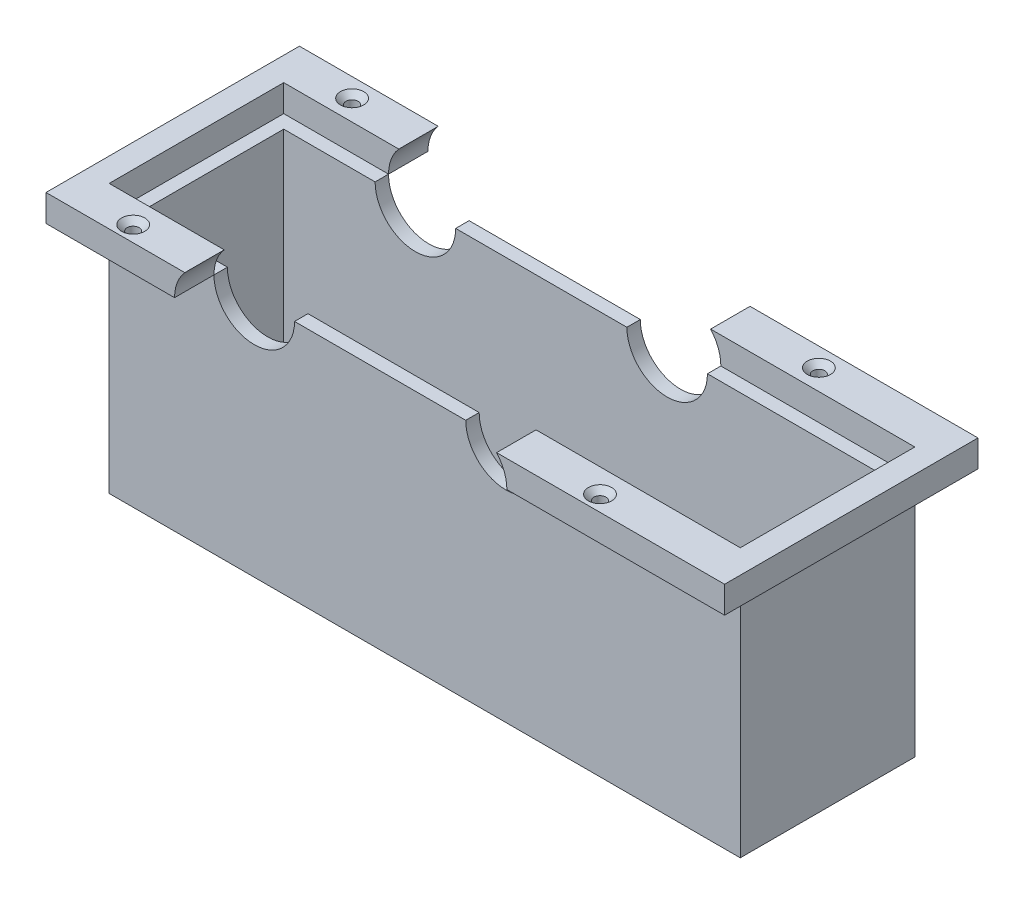
from build123d import *

# Parameters (mm, degrees)
SKETCH1_W                                    = 450
SKETCH1_H                                    = 110
BOSS_EXTRUDE1_DEPTH                          = 170
SHELL1_T                                     = 10
SKETCH2_R                                    = 30
CUT_EXTRUDE1_DEPTH                           = 250
SKETCH4_W                                    = 505.360173326
SKETCH4_H                                    = 188.738784552
SKETCH4_W_2                                  = 470
SKETCH4_H_2                                  = 130
BOSS_EXTRUDE3_DEPTH                          = 20
CUT_EXTRUDE4_DEPTH                           = 75
CUT_EXTRUDE4_DEPTH_BACK                      = 265
SKETCH2_4_R                                  = 30
CSK_FOR_M8_COUNTERSUNK_FLAT_HEAD_SCR_2_COUNT = 2
CSK_FOR_M8_COUNTERSUNK_FLAT_HEAD_SCR_2_PITCH = 163.017631271
CSK_FOR_M8_COUNTERSUNK_FLAT_HEAD_SCR_3_COUNT = 2
CSK_FOR_M8_COUNTERSUNK_FLAT_HEAD_SCR_3_PITCH = 347.641564167
CSK_FOR_M8_COUNTERSUNK_FLAT_HEAD_SCR_4_COUNT = 2
CSK_FOR_M8_COUNTERSUNK_FLAT_HEAD_SCR_4_PITCH = 383.965369847


with BuildPart() as part:
    # Sketch1 → Boss-Extrude1 (new body)
    with BuildSketch(Plane(origin=(0, 0, 0), x_dir=(1, 0, 0), z_dir=(0, 1, 0))):
        Rectangle(SKETCH1_W, SKETCH1_H)
    extrude(amount=BOSS_EXTRUDE1_DEPTH)

    # Shell1
    shell1_openings = [part.faces().sort_by_distance(p)[0] for p in [
        (0, 170, 0),
    ]]
    offset(amount=SHELL1_T, openings=shell1_openings, kind=Kind.INTERSECTION)

    # Sketch2 → Cut-Extrude1 (cut)
    with BuildSketch(Plane.XY.offset(65)):
        with Locations((-126.950391401, 170)):
            Circle(SKETCH2_R)
        with Locations((60.549608599, 170)):
            Circle(SKETCH2_R)
    extrude(amount=-CUT_EXTRUDE1_DEPTH, mode=Mode.SUBTRACT)


with BuildPart() as body_2:
    # Sketch4 → Boss-Extrude3 (new body)
    with BuildSketch(Plane(origin=(0, 170, 0), x_dir=(-1, 0, 0), z_dir=(0, -1, 0))):
        Rectangle(SKETCH4_W, SKETCH4_H)
        Rectangle(SKETCH4_W_2, SKETCH4_H_2, mode=Mode.SUBTRACT)
    extrude(amount=-BOSS_EXTRUDE3_DEPTH)

    # Sketch2<4> → Cut-Extrude4 (cut, two sides: drawn at the far end of the back side and taken through both)
    with BuildSketch(Plane.XY.offset(65).offset(-CUT_EXTRUDE4_DEPTH_BACK)):
        with Locations((-126.950391401, 170)):
            Circle(SKETCH2_4_R)
        with Locations((60.549608599, 170)):
            Circle(SKETCH2_4_R)
    extrude(amount=CUT_EXTRUDE4_DEPTH + CUT_EXTRUDE4_DEPTH_BACK, mode=Mode.SUBTRACT)


with BuildPart() as cut_extrude4_piece_1:
    # of the separate pieces the step leaves, piece 1, a body of its own (cut_extrude4_pieces_kept)
    add(body_2.part.solids().sort_by_distance((90.549608599, 170, -94.369392276))[0])


with BuildPart() as cut_extrude4_piece_2:
    # of the separate pieces the step leaves, piece 2, a body of its own (cut_extrude4_pieces_kept)
    add(body_2.part.solids().sort_by_distance((-252.680086663, 170, -94.369392276))[0])

    # Sketch7 → CSK for M8 Countersunk Flat Head Screw1 (revolve, cut)
    with BuildSketch(Plane(origin=(-199.443365859, 190, -80.345227372), x_dir=(0, 0, 1), z_dir=(1, 0, 0))):
        Polygon((0, 0), (0, 200), (4.5, 200), (4.5, 4.15), (8.65, 0), align=None)
    csk_for_m8_countersunk_flat_head_screw1 = revolve(axis=Axis((-199.443365859, 196.35, -80.345227372), (0, -1, 0)), mode=Mode.SUBTRACT)

    # CSK for M8 Countersunk Flat Head Scr 2: CSK for M8 Countersunk Flat Head Screw1 ×2
    with Locations(*[(0, 0, i * CSK_FOR_M8_COUNTERSUNK_FLAT_HEAD_SCR_2_PITCH) for i in range(1, CSK_FOR_M8_COUNTERSUNK_FLAT_HEAD_SCR_2_COUNT)]):
        add(csk_for_m8_countersunk_flat_head_screw1, mode=Mode.SUBTRACT)


with BuildPart() as cut_extrude4_piece_1_1:
    add(cut_extrude4_piece_1.part)

    # CSK for M8 Countersunk Flat Head Scr 3: CSK for M8 Countersunk Flat Head Screw1 ×2
    with Locations(*[(i * CSK_FOR_M8_COUNTERSUNK_FLAT_HEAD_SCR_3_PITCH, 0, 0) for i in range(1, CSK_FOR_M8_COUNTERSUNK_FLAT_HEAD_SCR_3_COUNT)]):
        add(csk_for_m8_countersunk_flat_head_screw1, mode=Mode.SUBTRACT)

    # CSK for M8 Countersunk Flat Head Scr 4: CSK for M8 Countersunk Flat Head Screw1 ×2
    with Locations(*[Vector(0.9053982245993311, 0, 0.42456336970160213) * (i * CSK_FOR_M8_COUNTERSUNK_FLAT_HEAD_SCR_4_PITCH) for i in range(1, CSK_FOR_M8_COUNTERSUNK_FLAT_HEAD_SCR_4_COUNT)]):
        add(csk_for_m8_countersunk_flat_head_screw1, mode=Mode.SUBTRACT)


solid = Compound([part.part, cut_extrude4_piece_2.part, cut_extrude4_piece_1_1.part])
